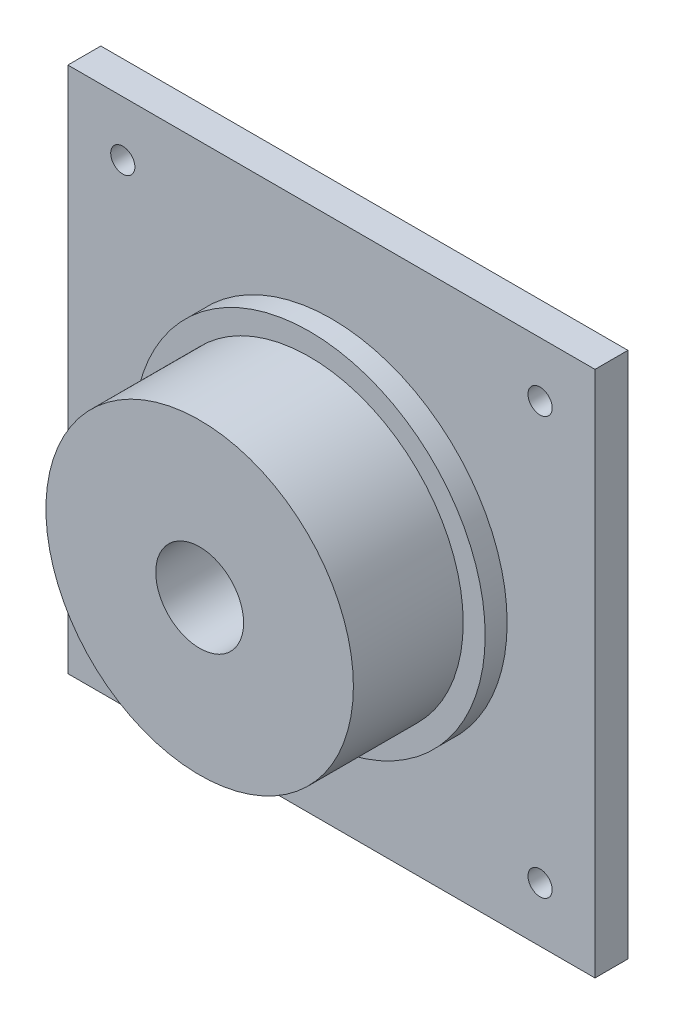
from build123d import *

# Parameters (mm, degrees)
SKETCH1_W           = 240
SKETCH1_H           = 240
SKETCH1_R           = 20
SKETCH1_R_2         = 5.5
BOSS_EXTRUDE1_DEPTH = 15
SKETCH2_R           = 70
SKETCH2_R_2         = 20
BOSS_EXTRUDE2_DEPTH = 75
SKETCH3_R           = 80
SKETCH3_R_2         = 40
SKETCH3_R_3         = 3
BOSS_EXTRUDE3_DEPTH = 25


with BuildPart() as part:
    # Sketch1 → Boss-Extrude1 (new body)
    with BuildSketch(Plane.XY):
        Rectangle(SKETCH1_W, SKETCH1_H)
        Circle(SKETCH1_R, mode=Mode.SUBTRACT)
        with Locations((-95, -95)):
            Circle(SKETCH1_R_2, mode=Mode.SUBTRACT)
        with Locations((-95, 95)):
            Circle(SKETCH1_R_2, mode=Mode.SUBTRACT)
        with Locations((95, -95)):
            Circle(SKETCH1_R_2, mode=Mode.SUBTRACT)
        with Locations((95, 95)):
            Circle(SKETCH1_R_2, mode=Mode.SUBTRACT)
    extrude(amount=BOSS_EXTRUDE1_DEPTH)

    # Sketch2 → Boss-Extrude2 (add)
    with BuildSketch(Plane.XY):
        Circle(SKETCH2_R)
        Circle(SKETCH2_R_2, mode=Mode.SUBTRACT)
    extrude(amount=BOSS_EXTRUDE2_DEPTH)

    # Sketch3 → Boss-Extrude3 (add)
    with BuildSketch(Plane.XY):
        Circle(SKETCH3_R)
        Circle(SKETCH3_R_2, mode=Mode.SUBTRACT)
        with Locations((65, 0)):
            Circle(SKETCH3_R_3, mode=Mode.SUBTRACT)
        with Locations((45.961940777, 45.961940777)):
            Circle(SKETCH3_R_3, mode=Mode.SUBTRACT)
        with Locations((0, 65)):
            Circle(SKETCH3_R_3, mode=Mode.SUBTRACT)
        with Locations((-45.961940777, 45.961940777)):
            Circle(SKETCH3_R_3, mode=Mode.SUBTRACT)
        with Locations((-65, 0)):
            Circle(SKETCH3_R_3, mode=Mode.SUBTRACT)
        with Locations((-45.961940777, -45.961940777)):
            Circle(SKETCH3_R_3, mode=Mode.SUBTRACT)
        with Locations((0, -65)):
            Circle(SKETCH3_R_3, mode=Mode.SUBTRACT)
        with Locations((45.961940777, -45.961940777)):
            Circle(SKETCH3_R_3, mode=Mode.SUBTRACT)
    extrude(amount=BOSS_EXTRUDE3_DEPTH)


solid = part.part
